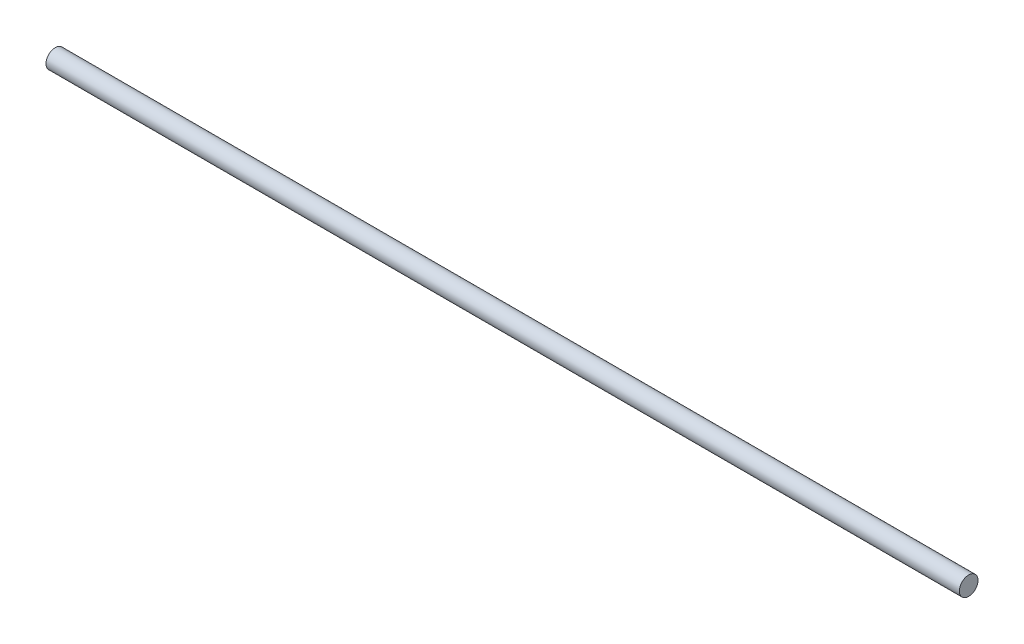
from build123d import *

# Parameters (mm, degrees)
SKETCH2_R           = 0.8
BOSS_EXTRUDE1_DEPTH = 78.5


with BuildPart() as part:
    # Sketch2 → Boss-Extrude1 (new body)
    with BuildSketch(Plane(origin=(0, 0, 0), x_dir=(0, 0, -1), z_dir=(1, 0, 0))):
        Circle(SKETCH2_R)
    extrude(amount=BOSS_EXTRUDE1_DEPTH)


solid = part.part
